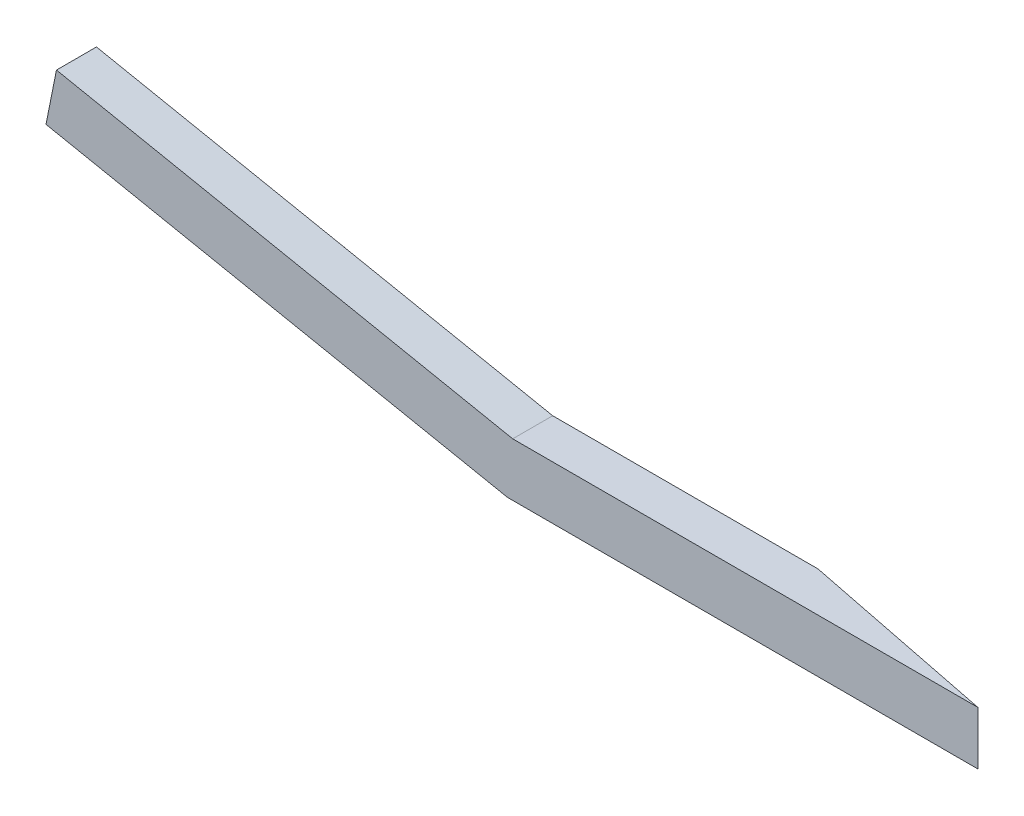
from build123d import *

# Parameters (mm, degrees)
BOSS_EXTRUDE2_DEPTH = 1.7
BOSS_EXTRUDE4_DEPTH = 1.274755


with BuildPart() as part:
    # Sketch1 → Boss-Extrude2 (new body)
    with BuildSketch(Plane(origin=(0, 0, 0), x_dir=(1, 0, 0), z_dir=(0, 1, 0))):
        Polygon((-1.878719766, -1.397030535), (-1.878719766, -0.122275657), (6.747505842, -0.122275657), (13.121280234, -1.397030535), align=None)
    extrude(amount=BOSS_EXTRUDE2_DEPTH)

    # Sketch4 → Boss-Extrude4 (add)
    with BuildSketch(Plane.XY.offset(1.397030535)):
        Polygon((-1.878719766, 0), (-16.587429902, 2.941742026), (-16.254032472, 4.608729175), (-1.545322337, 1.666987149), align=None)
    extrude(amount=-BOSS_EXTRUDE4_DEPTH)


solid = part.part
